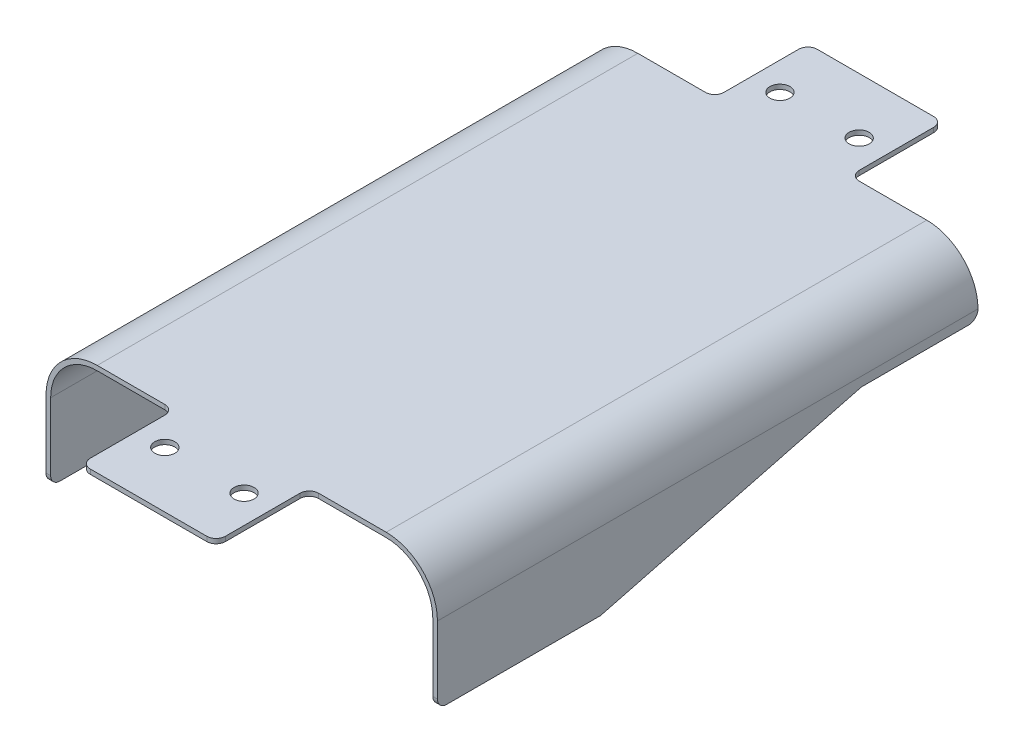
from build123d import *

# Parameters (mm, degrees)
BOSS_EXTRUDE1_DEPTH = 116
SKETCH2_W           = 29
SKETCH2_H           = 20
BOSS_EXTRUDE2_DEPTH = 1
CUT_EXTRUDE1_DEPTH  = 163.549223314
FILLET1_R           = 2
SKETCH4_R           = 2.15
CUT_EXTRUDE2_DEPTH  = 1


with BuildPart() as part:
    # Sketch1 → Boss-Extrude1 (new body)
    with BuildSketch(Plane.XY):
        with BuildLine():
            Line((42, -18.5), (42, 18.5))
            ThreePointArc((42, 18.5), (38.778174593, 26.278174593), (31, 29.5))
            Line((31, 29.5), (-31, 29.5))
            ThreePointArc((-31, 29.5), (-38.778174593, 26.278174593), (-42, 18.5))
            Line((-42, 18.5), (-42, -18.5))
            ThreePointArc((-42, -18.5), (-38.778174593, -26.278174593), (-31, -29.5))
            Line((-31, -29.5), (31, -29.5))
            ThreePointArc((31, -29.5), (38.778174593, -26.278174593), (42, -18.5))
        make_face()
        with BuildLine():
            ThreePointArc((-41, -18.5), (-38.071067812, -25.571067812), (-31, -28.5))
            Line((-31, -28.5), (31, -28.5))
            ThreePointArc((31, -28.5), (38.071067812, -25.571067812), (41, -18.5))
            Line((41, -18.5), (41, 18.5))
            ThreePointArc((41, 18.5), (38.071067812, 25.571067812), (31, 28.5))
            Line((31, 28.5), (-31, 28.5))
            ThreePointArc((-31, 28.5), (-38.071067812, 25.571067812), (-41, 18.5))
            Line((-41, 18.5), (-41, -18.5))
        make_face(mode=Mode.SUBTRACT)
    extrude(amount=-BOSS_EXTRUDE1_DEPTH)

    # Sketch2 → Boss-Extrude2 (add)
    with BuildSketch(Plane(origin=(0, 29.5, 0), x_dir=(1, 0, 0), z_dir=(0, 1, 0))):
        with Locations((0, -10)):
            Rectangle(SKETCH2_W, SKETCH2_H)
        with Locations((0, 126)):
            Rectangle(SKETCH2_W, SKETCH2_H)
    extrude(amount=-BOSS_EXTRUDE2_DEPTH)

    # Sketch3 → Cut-Extrude1 (cut, through all)
    with BuildSketch(Plane(origin=(42, 0, 0), x_dir=(0, 0, -1), z_dir=(1, 0, 0))):
        Polygon((0, 2), (35, 2), (91, 16.5), (116, 16.5), (116, -29.5), (0, -29.5), align=None)
    extrude(amount=-CUT_EXTRUDE1_DEPTH, mode=Mode.SUBTRACT)

    # Fillet1
    fillet1_edges = [part.edges().sort_by_distance(p)[0] for p in [
        (-41.5, 16.5, -116),
        (-14.5, 29, -136),
        (-14.5, 29, -116),
        (14.5, 29, -116),
        (14.5, 29, -136),
        (41.5, 16.5, -116),
        (-14.5, 29, 20),
        (14.5, 29, 20),
        (-14.5, 29, 0),
        (-41.5, 2, 0),
        (14.5, 29, 0),
        (41.5, 2, 0),
    ]]
    fillet(fillet1_edges, radius=FILLET1_R)

    # Sketch4 → Cut-Extrude2 (cut)
    with BuildSketch(Plane(origin=(0, 29.5, 0), x_dir=(1, 0, 0), z_dir=(0, 1, 0))):
        with Locations(Location((8.5, 124, 0), (0, 0, 180))):
            Circle(SKETCH4_R)
        with Locations(Location((-8.5, 124, 0), (0, 0, 180))):
            Circle(SKETCH4_R)
        with Locations(Location((8.5, -8, 0), (0, 0, 180))):
            Circle(SKETCH4_R)
        with Locations(Location((-8.5, -8, 0), (0, 0, 180))):
            Circle(SKETCH4_R)
    extrude(amount=-CUT_EXTRUDE2_DEPTH, mode=Mode.SUBTRACT)


solid = part.part
